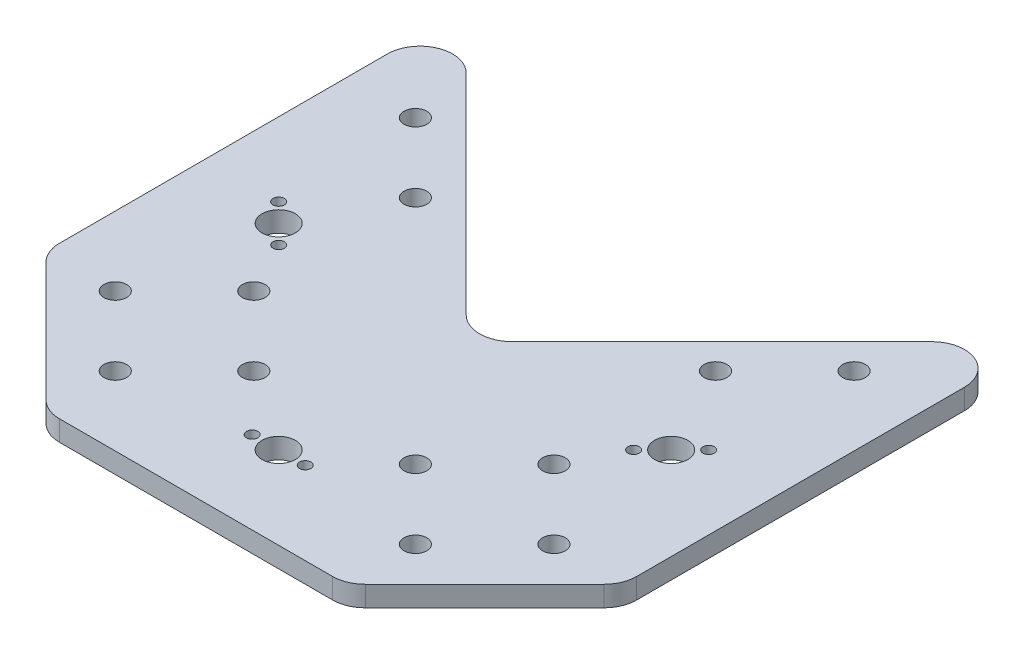
from build123d import *

# Parameters (mm, degrees)
SKETCH1_R           = 4.4196
BOSS_EXTRUDE1_DEPTH = 7.9375
CUT_EXTRUDE1_DEPTH  = 201.660251187
FILLET1_R           = 12.7
SKETCH3_R           = 6.477
SKETCH3_R_2         = 2.20345
CUT_EXTRUDE2_DEPTH  = 201.660251187


with BuildPart() as part:
    # Sketch1 → Boss-Extrude1 (new body)
    with BuildSketch(Plane(origin=(0, 0, 0), x_dir=(1, 0, 0), z_dir=(0, 1, 0))):
        Polygon((-112.253201513, -112.253201513), (-58.371664787, -166.13473824), (58.371664787, -166.13473824), (112.253201513, -112.253201513), (112.253201513, 58.371664787), (0, -53.881536726), (-112.253201513, 58.371664787), align=None)
        with Locations(Location((-85.31243315, -112.253201513, 0), (0, 0, 270))):
            Circle(SKETCH1_R, mode=Mode.SUBTRACT)
        with Locations(Location((-58.371664787, -85.31243315, 0), (0, 0, 270))):
            Circle(SKETCH1_R, mode=Mode.SUBTRACT)
        with Locations(Location((-31.430896424, -112.253201513, 0), (0, 0, 270))):
            Circle(SKETCH1_R, mode=Mode.SUBTRACT)
        with Locations(Location((-58.371664787, -139.193969877, 0), (0, 0, 270))):
            Circle(SKETCH1_R, mode=Mode.SUBTRACT)
        with Locations(Location((31.430896424, -112.253201513, 0), (0, 0, 270))):
            Circle(SKETCH1_R, mode=Mode.SUBTRACT)
        with Locations(Location((58.371664787, -85.31243315, 0), (0, 0, 270))):
            Circle(SKETCH1_R, mode=Mode.SUBTRACT)
        with Locations(Location((85.31243315, -112.253201513, 0), (0, 0, 270))):
            Circle(SKETCH1_R, mode=Mode.SUBTRACT)
        with Locations(Location((58.371664787, -139.193969877, 0), (0, 0, 270))):
            Circle(SKETCH1_R, mode=Mode.SUBTRACT)
        with Locations(Location((-85.31243315, 4.490128061, 0), (0, 0, 270))):
            Circle(SKETCH1_R, mode=Mode.SUBTRACT)
        with Locations(Location((-58.371664787, -22.450640303, 0), (0, 0, 270))):
            Circle(SKETCH1_R, mode=Mode.SUBTRACT)
        with Locations(Location((58.371664787, -22.450640303, 0), (0, 0, 270))):
            Circle(SKETCH1_R, mode=Mode.SUBTRACT)
        with Locations(Location((85.31243315, 4.490128061, 0), (0, 0, 270))):
            Circle(SKETCH1_R, mode=Mode.SUBTRACT)
    extrude(amount=BOSS_EXTRUDE1_DEPTH)

    # Sketch2 → Cut-Extrude1 (cut, through all)
    with BuildSketch(Plane(origin=(0, 7.9375, 0), x_dir=(1, 0, 0), z_dir=(0, 1, 0))):
        Polygon((0, -53.881536726), (-112.253201513, 58.371664787), (-112.253201513, 51.18745989), (0, -61.065741623), (112.253201513, 51.18745989), (112.253201513, 58.371664787), align=None)
    extrude(amount=-CUT_EXTRUDE1_DEPTH, mode=Mode.SUBTRACT)

    # Fillet1
    fillet1_edges = [part.edges().sort_by_distance(p)[0] for p in [
        (112.253201513, 3.96875, 112.253201513),
        (58.371664787, 3.96875, 166.13473824),
        (-58.371664787, 3.96875, 166.13473824),
        (-112.253201513, 3.96875, 112.253201513),
        (0, 3.96875, 61.065741623),
        (-112.253201513, 3.96875, -51.18745989),
        (112.253201513, 3.96875, -51.18745989),
    ]]
    fillet(fillet1_edges, radius=FILLET1_R)

    # Sketch3 → Cut-Extrude2 (cut, through all)
    with BuildSketch(Plane(origin=(0, 7.9375, 0), x_dir=(1, 0, 0), z_dir=(0, 1, 0))):
        with Locations(Location((0, -133.99727835, 0), (0, 0, 270))):
            Circle(SKETCH3_R)
        with Locations(Location((-10.31875, -133.99727835, 0), (0, 0, 270))):
            Circle(SKETCH3_R_2)
        with Locations(Location((10.31875, -133.99727835, 0), (0, 0, 270))):
            Circle(SKETCH3_R_2)
        with Locations(Location((-76.332177029, -57.665101321, 0), (0, 0, 270))):
            Circle(SKETCH3_R)
        with Locations(Location((-69.035718931, -64.961559419, 0), (0, 0, 270))):
            Circle(SKETCH3_R_2)
        with Locations(Location((-83.628635127, -50.368643222, 0), (0, 0, 270))):
            Circle(SKETCH3_R_2)
        with Locations(Location((76.332177029, -57.665101321, 0), (0, 0, 270))):
            Circle(SKETCH3_R)
        with Locations(Location((69.035718931, -64.961559419, 0), (0, 0, 270))):
            Circle(SKETCH3_R_2)
        with Locations(Location((83.628635127, -50.368643222, 0), (0, 0, 270))):
            Circle(SKETCH3_R_2)
    extrude(amount=-CUT_EXTRUDE2_DEPTH, mode=Mode.SUBTRACT)


solid = part.part
